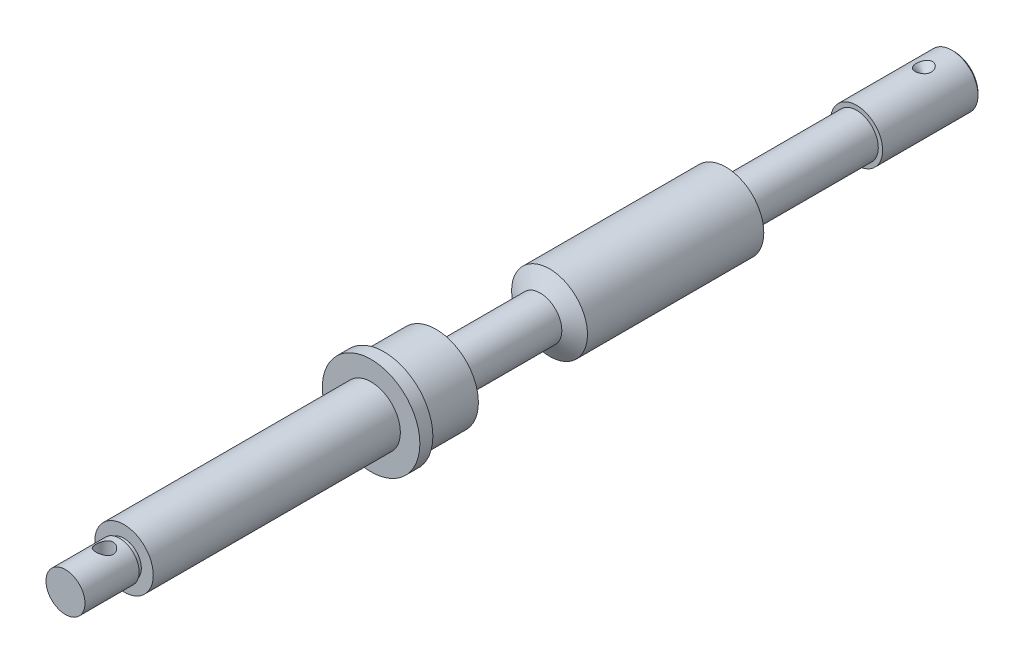
from build123d import *

# Parameters (mm, degrees)
SKETCH_1_R               = 12
EXTRUDE_1_DEPTH          = 45
SKETCH_2_R               = 10
EXTRUDE_2_DEPTH          = 56
SKETCH_3_R               = 17.5
EXTRUDE_3_DEPTH          = 90
SKETCH_4_R               = 10
EXTRUDE_4_DEPTH          = 72
SKETCH_5_R               = 19.5
EXTRUDE_5_DEPTH          = 24
CUT_EXTRUDE_1_DEPTH      = 265.441865067
CUT_EXTRUDE_1_DEPTH_BACK = 2
SKETCH_6_OUTSIDE_W       = 94.744
SKETCH_6_OUTSIDE_H       = 94.744
SKETCH_6_OUTSIDE_R       = 18.5
SKETCH_7_R               = 22.5
EXTRUDE_6_DEPTH          = 6
SKETCH_8_R               = 13.5
EXTRUDE_7_DEPTH          = 147
SKETCH_10_OUTSIDE_W      = 129.982
SKETCH_10_OUTSIDE_H      = 129.982
SKETCH_10_OUTSIDE_R      = 9
CUT_EXTRUDE_2_DEPTH      = 27
SKETCH_11_OUTSIDE_W      = 129.982
SKETCH_11_OUTSIDE_H      = 129.982
SKETCH_11_OUTSIDE_R      = 8
CUT_EXTRUDE_3_DEPTH      = 2
CHAMFER_1_SIZE           = 1
CUT_EXTRUDE_4_DEPTH      = 412.23290238
CUT_EXTRUDE_4_DEPTH_BACK = 412.23290238
SKETCH_15_R              = 4


with BuildPart() as part:
    # 草图1 → 凸台-拉伸1 (new body)
    with BuildSketch(Plane.XY):
        with Locations(Location((0, 0, 0), (0, 0, 180))):
            Circle(SKETCH_1_R)
    extrude(amount=EXTRUDE_1_DEPTH)

    # 草图2 → 凸台-拉伸2 (add)
    with BuildSketch(Plane.XY.offset(45)):
        Circle(SKETCH_2_R)
    extrude(amount=EXTRUDE_2_DEPTH)

    # 草图3 → 凸台-拉伸3 (add)
    with BuildSketch(Plane.XY.offset(101)):
        with Locations(Location((0, 0, 0), (0, 0, 180))):
            Circle(SKETCH_3_R)
    extrude(amount=EXTRUDE_3_DEPTH)

    # 草图4 → 凸台-拉伸4 (add)
    with BuildSketch(Plane.XY.offset(191)):
        Circle(SKETCH_4_R)
    extrude(amount=EXTRUDE_4_DEPTH)

    # 草图5 → 凸台-拉伸5 (add)
    with BuildSketch(Plane.XY.offset(263)):
        Circle(SKETCH_5_R)
    extrude(amount=-EXTRUDE_5_DEPTH)

    # 草图6 outside → 切除-拉伸1 (cut, two sides: drawn at the far end of the back side and taken through both)
    with BuildSketch(Plane.XY.offset(263).offset(-CUT_EXTRUDE_1_DEPTH_BACK)):
        Rectangle(SKETCH_6_OUTSIDE_W, SKETCH_6_OUTSIDE_H)
        with Locations(Location((0, 0, 0), (0, 0, 180))):
            Circle(SKETCH_6_OUTSIDE_R, mode=Mode.SUBTRACT)
    extrude(amount=CUT_EXTRUDE_1_DEPTH + CUT_EXTRUDE_1_DEPTH_BACK, mode=Mode.SUBTRACT)

    # 草图7 → 凸台-拉伸6 (add)
    with BuildSketch(Plane.XY.offset(263)):
        Circle(SKETCH_7_R)
    extrude(amount=EXTRUDE_6_DEPTH)

    # 草图8 → 凸台-拉伸7 (add)
    with BuildSketch(Plane(origin=(0, 0, 263), x_dir=(-1, 0, 0), z_dir=(0, 0, -1))):
        Circle(SKETCH_8_R)
    extrude(amount=-EXTRUDE_7_DEPTH)

    # 草图10 outside → 切除-拉伸2 (cut)
    with BuildSketch(Plane.XY.offset(410)):
        Rectangle(SKETCH_10_OUTSIDE_W, SKETCH_10_OUTSIDE_H)
        Circle(SKETCH_10_OUTSIDE_R, mode=Mode.SUBTRACT)
    extrude(amount=-CUT_EXTRUDE_2_DEPTH, mode=Mode.SUBTRACT)

    # 草图11 outside → 切除-拉伸3 (cut)
    with BuildSketch(Plane.XY.offset(383)):
        Rectangle(SKETCH_11_OUTSIDE_W, SKETCH_11_OUTSIDE_H)
        Circle(SKETCH_11_OUTSIDE_R, mode=Mode.SUBTRACT)
    extrude(amount=CUT_EXTRUDE_3_DEPTH, mode=Mode.SUBTRACT)

    # 草图12 → 切除-旋转1 (revolve, cut)
    with BuildSketch(Plane(origin=(0, 0, 0), x_dir=(0, 0, -1), z_dir=(1, 0, 0)), mode=Mode.PRIVATE) as cut_revolve_1_sk:
        Polygon((-105.330127019, 17.5), (-101, 10), (-101, 17.5), align=None)
        Polygon((-191, 10), (-191, 17.5), (-186.669872981, 17.5), align=None)
    revolve(cut_revolve_1_sk.sketch.rotate(Axis((0, 0, 181.277430572), (0, 0, -1)), 90), axis=Axis((0, 0, 181.277430572), (0, 0, -1)), mode=Mode.SUBTRACT)

    # 倒角1
    chamfer_1_edges = [part.edges().sort_by_distance(p)[0] for p in [
        (12, 0, 0),
    ]]
    chamfer(chamfer_1_edges, length=CHAMFER_1_SIZE)

    # 草图14 → 切除-旋转2 (revolve, cut)
    with BuildSketch(Plane(origin=(0, 0, 0), x_dir=(0, 0, -1), z_dir=(1, 0, 0))):
        Polygon((-14, 8), (-23.293093205, 17.293093205), (-14, 17.293093205), align=None)
    revolve(axis=Axis((0, -18.394712119, 14), (0, 1, 0)), mode=Mode.SUBTRACT)

    # 草图15 → 切除-拉伸4 (cut, two sides: drawn at the far end of the back side and taken through both)
    with BuildSketch(Plane(origin=(0, 0, 0), x_dir=(1, 0, 0), z_dir=(0, 1, 0)).offset(-CUT_EXTRUDE_4_DEPTH_BACK)):
        with Locations(Location((0, -392, 0), (0, 0, 270))):
            Circle(SKETCH_15_R)
    extrude(amount=CUT_EXTRUDE_4_DEPTH + CUT_EXTRUDE_4_DEPTH_BACK, mode=Mode.SUBTRACT)


solid = part.part
